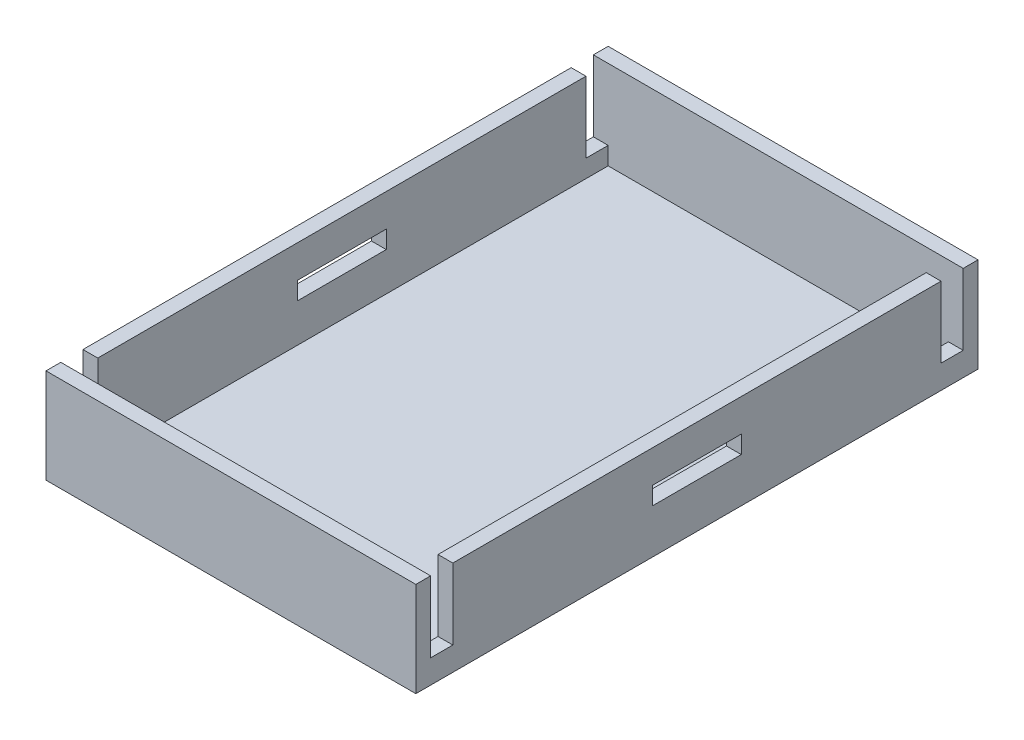
from build123d import *

# Parameters (mm, degrees)
SKETCH1_W               = 25
SKETCH1_H               = 38
BOSS_EXTRUDE1_DEPTH     = 6.4
CUT_EXTRUDE1_DEPTH      = 6
SKETCH2_3_W             = 1
SKETCH2_3_H             = 1.5
CUT_EXTRUDE2_DEPTH      = 4.8
CUT_EXTRUDE3_DEPTH      = 24.626468208
CUT_EXTRUDE3_DEPTH_BACK = 24.626468208
SKETCH3_W               = 6
SKETCH3_H               = 1.2


with BuildPart() as part:
    # Sketch1 → Boss-Extrude1 (new body)
    with BuildSketch(Plane(origin=(0, 0, 0), x_dir=(1, 0, 0), z_dir=(0, 1, 0))):
        Rectangle(SKETCH1_W, SKETCH1_H)
    extrude(amount=BOSS_EXTRUDE1_DEPTH)

    # Sketch2 → Cut-Extrude1 (cut)
    with BuildSketch(Plane(origin=(0, 6.4, 0), x_dir=(1, 0, 0), z_dir=(0, 1, 0))):
        Polygon((-11.5, -16.5), (-11.5, -18), (11.5, -18), (11.5, -16.5), (11.5, 16.5), (11.5, 18), (-11.5, 18), (-11.5, 16.5), align=None)
    extrude(amount=-CUT_EXTRUDE1_DEPTH, mode=Mode.SUBTRACT)

    # Sketch2<3> → Cut-Extrude2 (cut)
    with BuildSketch(Plane(origin=(0, 6.4, 0), x_dir=(1, 0, 0), z_dir=(0, 1, 0))):
        with Locations((-12, -17.25)):
            Rectangle(SKETCH2_3_W, SKETCH2_3_H)
        with Locations((12, -17.25)):
            Rectangle(SKETCH2_3_W, SKETCH2_3_H)
        with Locations((-12, 17.25)):
            Rectangle(SKETCH2_3_W, SKETCH2_3_H)
        with Locations((12, 17.25)):
            Rectangle(SKETCH2_3_W, SKETCH2_3_H)
    extrude(amount=-CUT_EXTRUDE2_DEPTH, mode=Mode.SUBTRACT)

    # Sketch3 → Cut-Extrude3 (cut, two sides: drawn at the far end of the back side and taken through both)
    with BuildSketch(Plane(origin=(0, 0, 0), x_dir=(0, 0, -1), z_dir=(1, 0, 0)).offset(-CUT_EXTRUDE3_DEPTH_BACK)):
        with Locations((0, 3.6)):
            Rectangle(SKETCH3_W, SKETCH3_H)
    extrude(amount=CUT_EXTRUDE3_DEPTH + CUT_EXTRUDE3_DEPTH_BACK, mode=Mode.SUBTRACT)


solid = part.part
